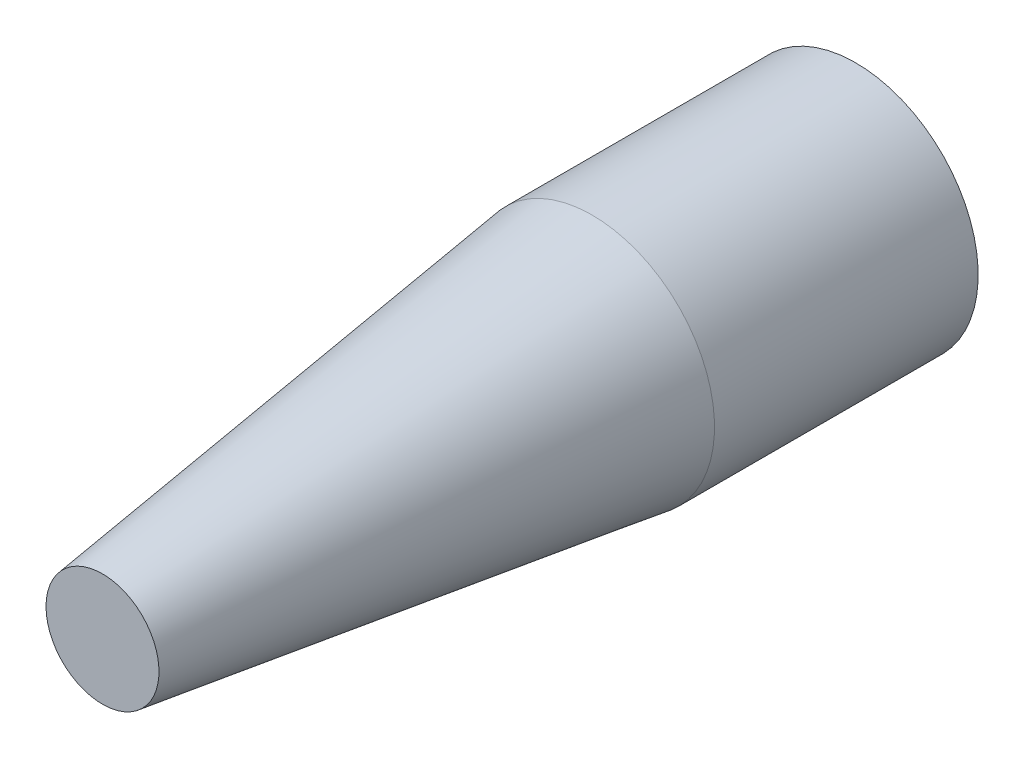
from build123d import *


with BuildPart() as part:
    # Эскиз1 → Повернуть2 (revolve)
    with BuildSketch(Plane(origin=(0, 0, 0), x_dir=(1, 0, 0), z_dir=(0, 1, 0))):
        Polygon((0, -11.216760381), (-1.5, -8), (-1.5, 0), (-3.25, 0), (-3.25, -7), (-1.5, -20), (0, -20), align=None)
    revolve(axis=Axis((0, 0, 0), (0, 0, 1)))


solid = part.part
